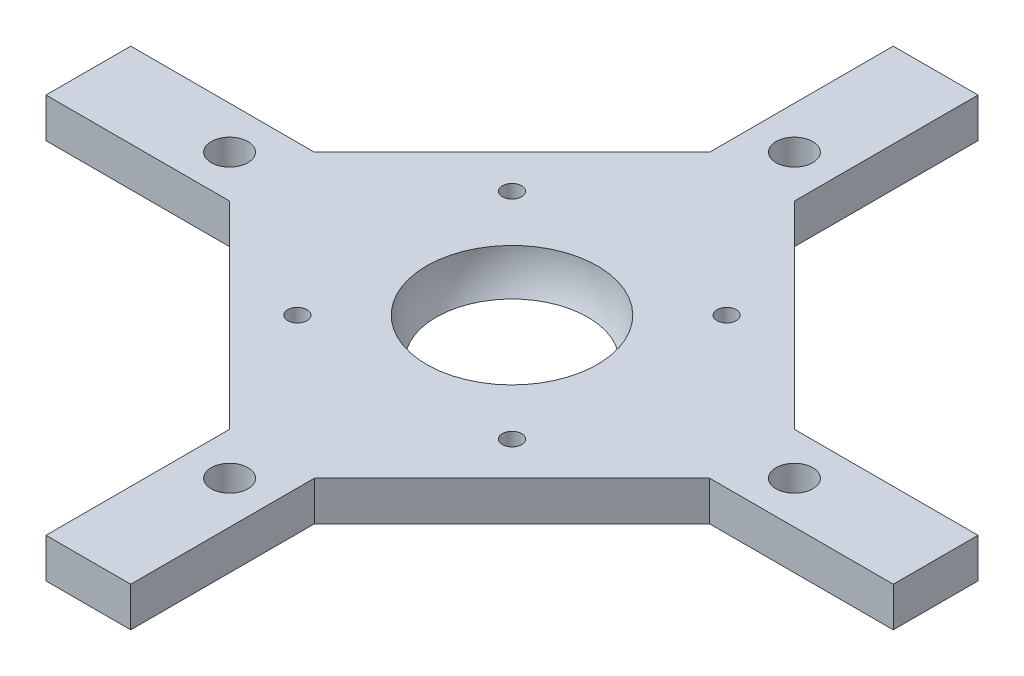
from build123d import *

# Parameters (mm, degrees)
SKETCH1_W               = 50
SKETCH1_H               = 50
BOSS_EXTRUDE1_DEPTH     = 25
CUT_EXTRUDE1_DEPTH      = 44.301270189
CUT_EXTRUDE1_DEPTH_BACK = 44.301270189
SKETCH3_R               = 5.1
CUT_EXTRUDE2_DEPTH      = 62.23724357
CUT_EXTRUDE2_DEPTH_BACK = 62.23724357
SKETCH4_W               = 50
SKETCH4_H               = 18
CUT_EXTRUDE3_START      = -2.5
SKETCH5_R               = 1.7
CUT_EXTRUDE3_DEPTH      = 34.541642582
CUT_EXTRUDE5_DEPTH      = 37.041642582
CUT_EXTRUDE5_DEPTH_BACK = 37.041642582
SKETCH6_R               = 1.7
BOSS_EXTRUDE5_DEPTH     = 7
SKETCH8_R               = 3.25
CUT_EXTRUDE6_DEPTH      = 107.296754419
CIRPATTERN1_COUNT       = 4


with BuildPart() as part:
    # Sketch1 → Boss-Extrude1 (new body)
    with BuildSketch(Plane(origin=(0, 0, 0), x_dir=(1, 0, 0), z_dir=(0, 1, 0))):
        Rectangle(SKETCH1_W, SKETCH1_H)
    extrude(amount=BOSS_EXTRUDE1_DEPTH)

    # Sketch2 → Cut-Revolve1 (revolve, cut)
    with BuildSketch(Plane.XY):
        with BuildLine():
            Line((-15.125, 25), (0, 25))
            Line((0, 25), (0, 9.875))
            ThreePointArc((0, 9.875), (-10.694990065, 14.305009935), (-15.125, 25))
        make_face()
    revolve(axis=Axis((0, 25, 0), (0, -1, 0)), mode=Mode.SUBTRACT)

    # Sketch3 → Cut-Extrude1 (cut, two sides: drawn at the far end of the back side and taken through both)
    with BuildSketch(Plane.XZ.offset(-CUT_EXTRUDE1_DEPTH_BACK)):
        with Locations(Location((0, 0, 0), (0, 0, 90))):
            Circle(SKETCH3_R)
    extrude(amount=CUT_EXTRUDE1_DEPTH + CUT_EXTRUDE1_DEPTH_BACK, mode=Mode.SUBTRACT)

    # Sketch4 → Cut-Extrude2 (cut, two sides: drawn at the far end of the back side and taken through both)
    with BuildSketch(Plane.ZY.offset(25).offset(-CUT_EXTRUDE2_DEPTH_BACK)):
        with Locations((0, 9)):
            Rectangle(SKETCH4_W, SKETCH4_H)
    extrude(amount=CUT_EXTRUDE2_DEPTH + CUT_EXTRUDE2_DEPTH_BACK, mode=Mode.SUBTRACT)

    # Sketch5 → Cut-Extrude3 (cut, through all)
    # profile 1 of 4: a face of its own
    with BuildSketch(Plane(origin=(0, 25, 0), x_dir=(1, 0, 0), z_dir=(0, 1, 0)).offset(CUT_EXTRUDE3_START)):
        Polygon((22.03934257, 19.814389387), (19.814389387, 22.03934257), (16.775046817, 21.224953183), (15.96065743, 18.185610613), (18.185610613, 15.96065743), (21.224953183, 16.775046817), align=None)
        with Locations(Location((19, 19, 0), (0, 0, 270))):
            Circle(SKETCH5_R, mode=Mode.SUBTRACT)
    # profile 2 of 4: a face of its own
    with BuildSketch(Plane(origin=(0, 25, 0), x_dir=(1, 0, 0), z_dir=(0, 1, 0)).offset(CUT_EXTRUDE3_START)):
        Polygon((-16.775046817, 21.224953183), (-19.814389387, 22.03934257), (-22.03934257, 19.814389387), (-21.224953183, 16.775046817), (-18.185610613, 15.96065743), (-15.96065743, 18.185610613), align=None)
        with Locations(Location((-19, 19, 0), (0, 0, 270))):
            Circle(SKETCH5_R, mode=Mode.SUBTRACT)
    # profile 3 of 4: a face of its own
    with BuildSketch(Plane(origin=(0, 25, 0), x_dir=(1, 0, 0), z_dir=(0, 1, 0)).offset(CUT_EXTRUDE3_START)):
        Polygon((19.814389387, -22.03934257), (22.03934257, -19.814389387), (21.224953183, -16.775046817), (18.185610613, -15.96065743), (15.96065743, -18.185610613), (16.775046817, -21.224953183), align=None)
        with Locations(Location((19, -19, 0), (0, 0, 270))):
            Circle(SKETCH5_R, mode=Mode.SUBTRACT)
    # profile 4 of 4: a face of its own
    with BuildSketch(Plane(origin=(0, 25, 0), x_dir=(1, 0, 0), z_dir=(0, 1, 0)).offset(CUT_EXTRUDE3_START)):
        Polygon((-22.03934257, -19.814389387), (-19.814389387, -22.03934257), (-16.775046817, -21.224953183), (-15.96065743, -18.185610613), (-18.185610613, -15.96065743), (-21.224953183, -16.775046817), align=None)
        with Locations(Location((-19, -19, 0), (0, 0, 270))):
            Circle(SKETCH5_R, mode=Mode.SUBTRACT)
    extrude(amount=-CUT_EXTRUDE3_DEPTH, mode=Mode.SUBTRACT)

    # Sketch6 → Cut-Extrude5 (cut, two sides: drawn at the far end of the back side and taken through both)
    with BuildSketch(Plane.XZ.offset(-18).offset(-CUT_EXTRUDE5_DEPTH_BACK)):
        with Locations(Location((-19, -19, 0), (0, 0, 270))):
            Circle(SKETCH6_R)
        with Locations(Location((19, -19, 0), (0, 0, 270))):
            Circle(SKETCH6_R)
        with Locations(Location((19, 19, 0), (0, 0, 270))):
            Circle(SKETCH6_R)
        with Locations(Location((-19, 19, 0), (0, 0, 270))):
            Circle(SKETCH6_R)
    extrude(amount=CUT_EXTRUDE5_DEPTH + CUT_EXTRUDE5_DEPTH_BACK, mode=Mode.SUBTRACT)

    # Sketch7 → Boss-Extrude5 (add)
    with BuildSketch(Plane.XZ.offset(-18)):
        Polygon((42.5, 7.5), (25, 25), (25, -25), (42.5, -7.5), (75, -7.5), (75, 7.5), align=None)
        Polygon((-25, 25), (25, 25), (7.5, 42.5), (7.5, 75), (-7.5, 75), (-7.5, 42.5), align=None)
        Polygon((7.5, -42.5), (25, -25), (-25, -25), (-7.5, -42.5), (-7.5, -75), (7.5, -75), align=None)
        Polygon((-25, -25), (-25, 25), (-42.5, 7.5), (-75, 7.5), (-75, -7.5), (-42.5, -7.5), align=None)
    extrude(amount=-BOSS_EXTRUDE5_DEPTH)

    # Sketch8 → Cut-Extrude6 (cut, symmetric)
    with BuildSketch(Plane.XZ.offset(-18)):
        with Locations(Location((50, 0, 0), (0, 0, 270))):
            Circle(SKETCH8_R)
    cut_extrude6 = extrude(amount=CUT_EXTRUDE6_DEPTH, both=True, mode=Mode.SUBTRACT)

    # CirPattern1: Cut-Extrude6 ×4 about axis
    cirpattern1_axis = Axis((0, 0, 0), (0, 1, 0))
    for i in range(1, CIRPATTERN1_COUNT):
        add(cut_extrude6.rotate(cirpattern1_axis, i * 360 / CIRPATTERN1_COUNT), mode=Mode.SUBTRACT)

    # Sketch2<2> → Cut-Revolve2 (revolve, cut)
    with BuildSketch(Plane.XY):
        with BuildLine():
            Line((-15.125, 25), (0, 25))
            Line((0, 25), (0, 9.875))
            ThreePointArc((0, 9.875), (-10.694990065, 14.305009935), (-15.125, 25))
        make_face()
    revolve(axis=Axis((0, 25, 0), (0, -1, 0)), mode=Mode.SUBTRACT)


solid = part.part
